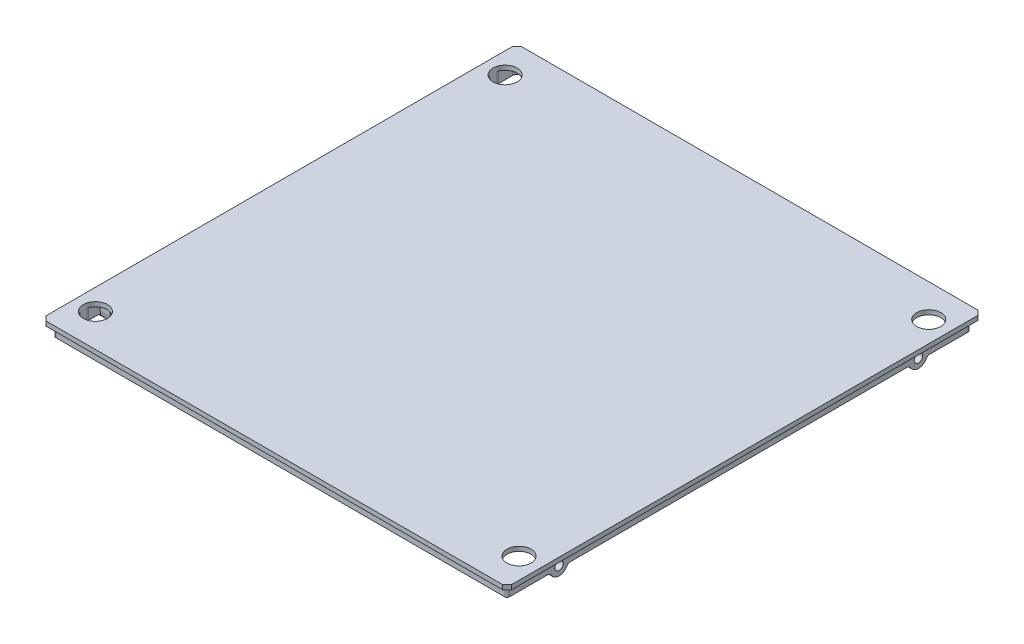
from build123d import *

# Parameters (mm, degrees)
SKETCH_1_W          = 104.4
SKETCH_1_H          = 106.6
EXTRUDE_1_DEPTH     = 1
SKETCH_2_W          = 101.7
SKETCH_2_H          = 103.9
SKETCH_2_W_2        = 100.1
SKETCH_2_H_2        = 102.3
EXTRUDE_2_DEPTH     = 2.5
SKETCH_4_R          = 2.7
CUT_EXTRUDE_1_DEPTH = 75.685875505
EXTRUDE_3_DEPTH     = 2.5
FILLET_1_R          = 1
FILLET_2_R          = 0.5
CHAMFER_1_SIZE      = 1
SKETCH_6_R          = 2
SKETCH_6_R_2        = 0.95
EXTRUDE_4_DEPTH     = 0.8
EXTRUDE_START       = -0.8
SKETCH_7_R          = 2
SKETCH_7_R_2        = 0.95
EXTRUDE_5_DEPTH     = 0.8
SKETCH_8_R          = 0.95
CUT_EXTRUDE_2_DEPTH = 0.8
CUT_EXTRUDE_START   = -0.8
SKETCH_9_R          = 0.95
CUT_EXTRUDE_3_DEPTH = 0.8
FILLET_3_R          = 1
EXTRUDE_START_2     = -3
SKETCH_10_R         = 0.95
EXTRUDE_6_DEPTH     = 3
SKETCH_11_R         = 0.95
EXTRUDE_7_DEPTH     = 3


with BuildPart() as part:
    # 草图1 → 凸台-拉伸1 (new body)
    with BuildSketch(Plane(origin=(0, 0, 0), x_dir=(1, 0, 0), z_dir=(0, 1, 0))):
        Rectangle(SKETCH_1_W, SKETCH_1_H)
    extrude(amount=EXTRUDE_1_DEPTH)

    # 草图2 → 凸台-拉伸2 (add)
    with BuildSketch(Plane.XZ):
        Rectangle(SKETCH_2_W, SKETCH_2_H)
        Rectangle(SKETCH_2_W_2, SKETCH_2_H_2, mode=Mode.SUBTRACT)
    extrude(amount=EXTRUDE_2_DEPTH)

    # 草图4 → 切除-拉伸1 (cut, through all)
    with BuildSketch(Plane(origin=(0, 1, 0), x_dir=(1, 0, 0), z_dir=(0, 1, 0))):
        with Locations(Location((47.5, 45.95, 0), (0, 0, 270))):
            Circle(SKETCH_4_R)
        with Locations(Location((-47.5, 45.95, 0), (0, 0, 270))):
            Circle(SKETCH_4_R)
        with Locations(Location((-47.5, -45.925, 0), (0, 0, 270))):
            Circle(SKETCH_4_R)
        with Locations(Location((47.5, -45.925, 0), (0, 0, 270))):
            Circle(SKETCH_4_R)
    extrude(amount=-CUT_EXTRUDE_1_DEPTH, mode=Mode.SUBTRACT)

    # 草图5 → 凸台-拉伸3 (add)
    with BuildSketch(Plane.XZ):
        Polygon((0.4, 51.15), (-0.4, 51.15), (-0.4, 0.4), (-50.05, 0.4), (-50.05, -0.4), (-0.4, -0.4), (-0.4, -51.15), (0.4, -51.15), (0.4, -0.4), (50.05, -0.4), (50.05, 0.4), (0.4, 0.4), align=None)
    extrude(amount=EXTRUDE_3_DEPTH)

    # 圆角1
    fillet_1_edges = [part.edges().sort_by_distance(p)[0] for p in [
        (-0.4, -1.25, 0.4),
        (-50.05, -1.25, 0.4),
        (-50.05, -1.25, -0.4),
        (50.05, -1.25, -0.4),
        (0.4, -1.25, 0.4),
        (50.05, -1.25, 0.4),
        (0.4, -1.25, -0.4),
        (0.4, -1.25, -51.15),
        (-0.4, -1.25, -51.15),
        (-0.4, -1.25, -0.4),
        (0.4, -1.25, 51.15),
        (-0.4, -1.25, 51.15),
        (50.05, -1.25, -51.15),
        (50.05, -1.25, 51.15),
        (-50.05, -1.25, 51.15),
        (-50.05, -1.25, -51.15),
        (50.05, -1.25, 46.812411967),
        (50.05, -1.25, 45.037588033),
        (-50.05, -1.25, 45.037588033),
        (-50.05, -1.25, 46.812411967),
        (-50.05, -1.25, -46.837411967),
        (-50.05, -1.25, -45.062588033),
        (50.05, -1.25, -45.062588033),
        (50.05, -1.25, -46.837411967),
    ]]
    fillet(fillet_1_edges, radius=FILLET_1_R)

    # 圆角2
    fillet_2_edges = [part.edges().sort_by_distance(p)[0] for p in [
        (-50.85, -1.25, -51.95),
        (50.85, -1.25, -51.95),
        (50.85, -1.25, 51.95),
        (-50.85, -1.25, 51.95),
    ]]
    fillet(fillet_2_edges, radius=FILLET_2_R)

    # 倒角1
    chamfer_1_edges = [part.edges().sort_by_distance(p)[0] for p in [
        (52.2, 0.5, 53.3),
        (-52.2, 0.5, 53.3),
        (-52.2, 0.5, -53.3),
        (52.2, 0.5, -53.3),
    ]]
    chamfer(chamfer_1_edges, length=CHAMFER_1_SIZE)

    # 草图6 → 凸台-拉伸4 (add)
    # profile 1 of 2: a face of its own
    with BuildSketch(Plane(origin=(50.85, 0, 0), x_dir=(0, 0, -1), z_dir=(1, 0, 0))):
        with Locations((-40.3, -2)):
            Circle(SKETCH_6_R)
        with Locations((-40.3, -2)):
            Circle(SKETCH_6_R_2, mode=Mode.SUBTRACT)
    # profile 2 of 2: a face of its own
    with BuildSketch(Plane(origin=(50.85, 0, 0), x_dir=(0, 0, -1), z_dir=(1, 0, 0))):
        with Locations((40.3, -2)):
            Circle(SKETCH_6_R)
        with Locations((40.3, -2)):
            Circle(SKETCH_6_R_2, mode=Mode.SUBTRACT)
    extrude(amount=-EXTRUDE_4_DEPTH)

    # 草图7 → 凸台-拉伸5 (add)
    # profile 1 of 2: a face of its own
    with BuildSketch(Plane.ZY.offset(50.85).offset(EXTRUDE_START)):
        with Locations((-40.3, -2)):
            Circle(SKETCH_7_R)
        with Locations((-40.3, -2)):
            Circle(SKETCH_7_R_2, mode=Mode.SUBTRACT)
    # profile 2 of 2: a face of its own
    with BuildSketch(Plane.ZY.offset(50.85).offset(EXTRUDE_START)):
        with Locations((40.3, -2)):
            Circle(SKETCH_7_R)
        with Locations((40.3, -2)):
            Circle(SKETCH_7_R_2, mode=Mode.SUBTRACT)
    extrude(amount=EXTRUDE_5_DEPTH)

    # 草图8 → 切除-拉伸2 (cut)
    with BuildSketch(Plane(origin=(50.85, 0, 0), x_dir=(0, 0, -1), z_dir=(1, 0, 0))):
        with Locations(Location((40.3, -2, 0), (0, 0, 180))):
            Circle(SKETCH_8_R)
        with Locations((-40.3, -2)):
            Circle(SKETCH_8_R)
    extrude(amount=-CUT_EXTRUDE_2_DEPTH, mode=Mode.SUBTRACT)

    # 草图9 → 切除-拉伸3 (cut)
    with BuildSketch(Plane.ZY.offset(50.85).offset(CUT_EXTRUDE_START)):
        with Locations(Location((40.3, -2, 0), (0, 0, 180))):
            Circle(SKETCH_9_R)
        with Locations((-40.3, -2)):
            Circle(SKETCH_9_R)
    extrude(amount=CUT_EXTRUDE_3_DEPTH, mode=Mode.SUBTRACT)

    # 圆角3
    fillet_3_edges = [part.edges().sort_by_distance(p)[0] for p in [
        (50.45, -2.5, 38.363508327),
        (50.45, -2.5, 42.236491673),
        (50.45, -2.5, -42.236491673),
        (50.45, -2.5, -38.363508327),
        (-50.45, -2.5, -38.363508327),
        (-50.45, -2.5, -42.236491673),
        (-50.45, -2.5, 42.236491673),
        (-50.45, -2.5, 38.363508327),
    ]]
    fillet(fillet_3_edges, radius=FILLET_3_R)

    # 草图10 → 凸台-拉伸6 (add)
    # profile 1 of 2: a face of its own
    with BuildSketch(Plane.ZY.offset(50.85).offset(EXTRUDE_START_2)):
        with BuildLine():
            Line((-42.3, -2), (-42.3, 0))
            Line((-42.3, 0), (-38.3, 0))
            Line((-38.3, 0), (-38.3, -2))
            ThreePointArc((-38.3, -2), (-40.3, -4), (-42.3, -2))
        make_face()
        with Locations((-40.3, -2)):
            Circle(SKETCH_10_R, mode=Mode.SUBTRACT)
    # profile 2 of 2: a face of its own
    with BuildSketch(Plane.ZY.offset(50.85).offset(EXTRUDE_START_2)):
        with BuildLine():
            Line((38.3, -2), (38.3, 0))
            Line((38.3, 0), (42.3, 0))
            Line((42.3, 0), (42.3, -2))
            ThreePointArc((42.3, -2), (40.3, -4), (38.3, -2))
        make_face()
        with Locations(Location((40.3, -2, 0), (0, 0, 180))):
            Circle(SKETCH_10_R, mode=Mode.SUBTRACT)
    extrude(amount=EXTRUDE_6_DEPTH)

    # 草图11 → 凸台-拉伸7 (add)
    # profile 1 of 2: a face of its own
    with BuildSketch(Plane(origin=(50.85, 0, 0), x_dir=(0, 0, -1), z_dir=(1, 0, 0))):
        with BuildLine():
            Line((-38.3, -2), (-38.3, 0))
            Line((-38.3, 0), (-42.3, 0))
            Line((-42.3, 0), (-42.3, -2))
            ThreePointArc((-42.3, -2), (-40.3, -4), (-38.3, -2))
        make_face()
        with Locations((-40.3, -2)):
            Circle(SKETCH_11_R, mode=Mode.SUBTRACT)
    # profile 2 of 2: a face of its own
    with BuildSketch(Plane(origin=(50.85, 0, 0), x_dir=(0, 0, -1), z_dir=(1, 0, 0))):
        with BuildLine():
            Line((42.3, -2), (42.3, 0))
            Line((42.3, 0), (38.3, 0))
            Line((38.3, 0), (38.3, -2))
            ThreePointArc((38.3, -2), (40.3, -4), (42.3, -2))
        make_face()
        with Locations((40.3, -2)):
            Circle(SKETCH_11_R, mode=Mode.SUBTRACT)
    extrude(amount=-EXTRUDE_7_DEPTH)


solid = part.part
